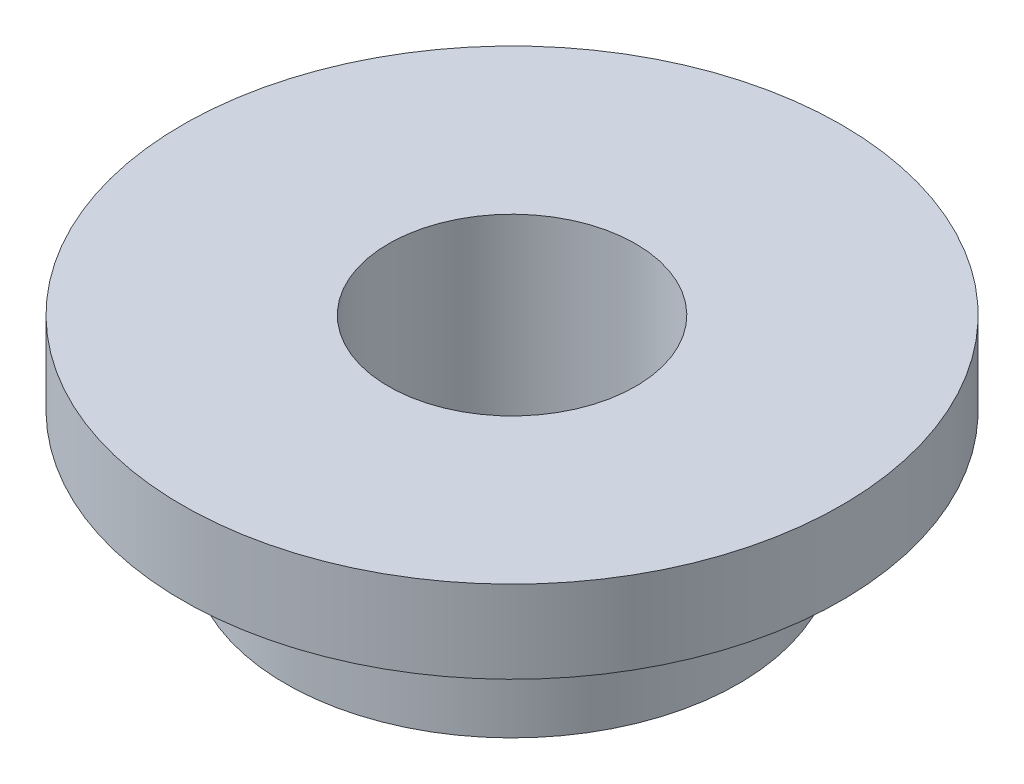
from build123d import *


with BuildPart() as part:
    # Sketch1 → Revolve1 (revolve)
    with BuildSketch(Plane(origin=(0, 0, 0), x_dir=(0, 0, -1), z_dir=(1, 0, 0))):
        Polygon((6, 0), (6, 10), (16, 10), (16, 6), (11, 6), (11, 0), align=None)
    revolve(axis=Axis((0, 0, 0), (0, 1, 0)))


solid = part.part
